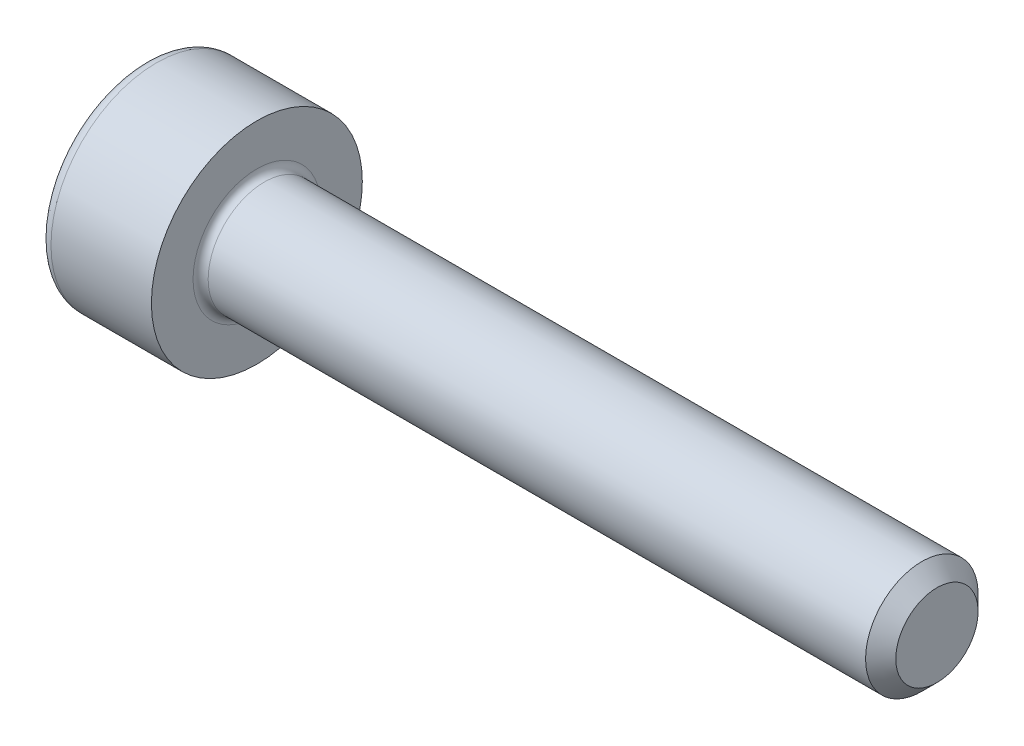
from build123d import *

# Parameters (mm, degrees)
FILLET1_R      = 0.1
FILLET2_R      = 0.16
CHAMFER1_SIZE  = 0.2
EXTRUDE1_DEPTH = 0.7


with BuildPart() as part:
    # Sketch1 → Revolve1 (revolve)
    with BuildSketch(Plane.XY, mode=Mode.PRIVATE) as revolve1_sk:
        Polygon((0, 1.395688245), (0, 0), (10.488734128, 0), (10.488734128, 0.744367064), (1.488734128, 0.744367064), (1.488734128, 1.395688245), align=None)
    revolve(revolve1_sk.sketch.rotate(Axis((0, 0, 0), (1, 0, 0)), 90), axis=Axis((0, 0, 0), (1, 0, 0)))

    # Fillet1
    fillet1_edges = [part.edges().sort_by_distance(p)[0] for p in [
        (1.488734128, 0, -0.744367064),
    ]]
    fillet(fillet1_edges, radius=FILLET1_R)

    # Fillet2
    fillet2_edges = [part.edges().sort_by_distance(p)[0] for p in [
        (0, 0, -1.395688245),
    ]]
    fillet(fillet2_edges, radius=FILLET2_R)

    # Chamfer1
    chamfer1_edges = [part.edges().sort_by_distance(p)[0] for p in [
        (10.488734128, 0, -0.744367064),
    ]]
    chamfer(chamfer1_edges, length=CHAMFER1_SIZE)

    # Sketch2 → Extrude1 (cut)
    with BuildSketch(Plane.ZY):
        Polygon((0, 0.877572409), (-0.76, 0.438786205), (-0.76, -0.438786205), (0, -0.877572409), (0.76, -0.438786205), (0.76, 0.438786205), align=None)
    extrude(amount=-EXTRUDE1_DEPTH, mode=Mode.SUBTRACT)


solid = part.part
